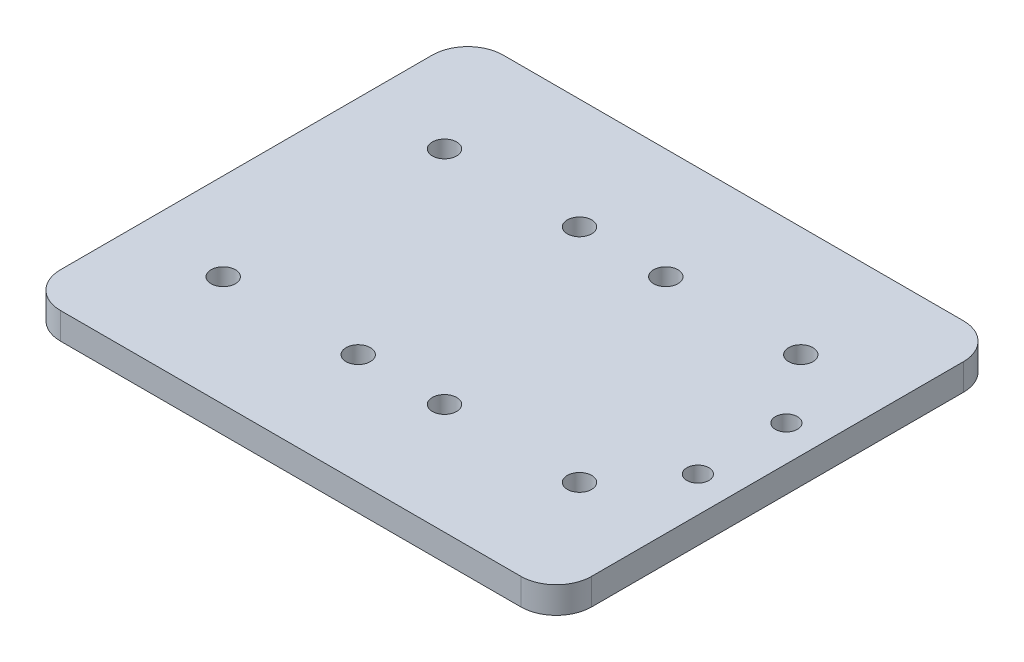
from build123d import *

# Parameters (mm, degrees)
ESBO_O1_W                = 120
ESBO_O1_H                = 100
RESSALTO_EXTRUS_O1_DEPTH = 6
ESBO_O2_R                = 2.75
CORTE_EXTRUS_O1_DEPTH    = 79.33262411
FILETE1_R                = 8
ESBO_O3_R                = 2.5
CORTE_EXTRUS_O2_DEPTH    = 79.33262411


with BuildPart() as part:
    # Esboço1 → Ressalto-extrusão1 (new body)
    with BuildSketch(Plane(origin=(0, 0, 0), x_dir=(1, 0, 0), z_dir=(0, 1, 0))):
        Rectangle(ESBO_O1_W, ESBO_O1_H)
    extrude(amount=RESSALTO_EXTRUS_O1_DEPTH)

    # Esboço2 → Corte-extrusão1 (cut, through all)
    with BuildSketch(Plane(origin=(0, 6, 0), x_dir=(1, 0, 0), z_dir=(0, 1, 0))):
        with Locations(Location((9.75, 25, 0), (0, 0, 270))):
            Circle(ESBO_O2_R)
        with Locations(Location((40.25, 25, 0), (0, 0, 270))):
            Circle(ESBO_O2_R)
        with Locations(Location((9.75, -25, 0), (0, 0, 270))):
            Circle(ESBO_O2_R)
        with Locations(Location((40.25, -25, 0), (0, 0, 270))):
            Circle(ESBO_O2_R)
        with Locations(Location((-40.25, -25, 0), (0, 0, 90))):
            Circle(ESBO_O2_R)
        with Locations(Location((-9.75, -25, 0), (0, 0, 90))):
            Circle(ESBO_O2_R)
        with Locations(Location((-40.25, 25, 0), (0, 0, 90))):
            Circle(ESBO_O2_R)
        with Locations(Location((-9.75, 25, 0), (0, 0, 90))):
            Circle(ESBO_O2_R)
    extrude(amount=-CORTE_EXTRUS_O1_DEPTH, mode=Mode.SUBTRACT)

    # Filete1
    filete1_edges = [part.edges().sort_by_distance(p)[0] for p in [
        (60, 3, 50),
        (-60, 3, 50),
        (-60, 3, -50),
        (60, 3, -50),
    ]]
    fillet(filete1_edges, radius=FILETE1_R)

    # Esboço3 → Corte-extrusão2 (cut, through all)
    with BuildSketch(Plane(origin=(0, 6, 0), x_dir=(1, 0, 0), z_dir=(0, 1, 0))):
        with Locations(Location((52, 10, 0), (0, 0, 270))):
            Circle(ESBO_O3_R)
        with Locations(Location((52, -10, 0), (0, 0, 270))):
            Circle(ESBO_O3_R)
    extrude(amount=-CORTE_EXTRUS_O2_DEPTH, mode=Mode.SUBTRACT)


solid = part.part
